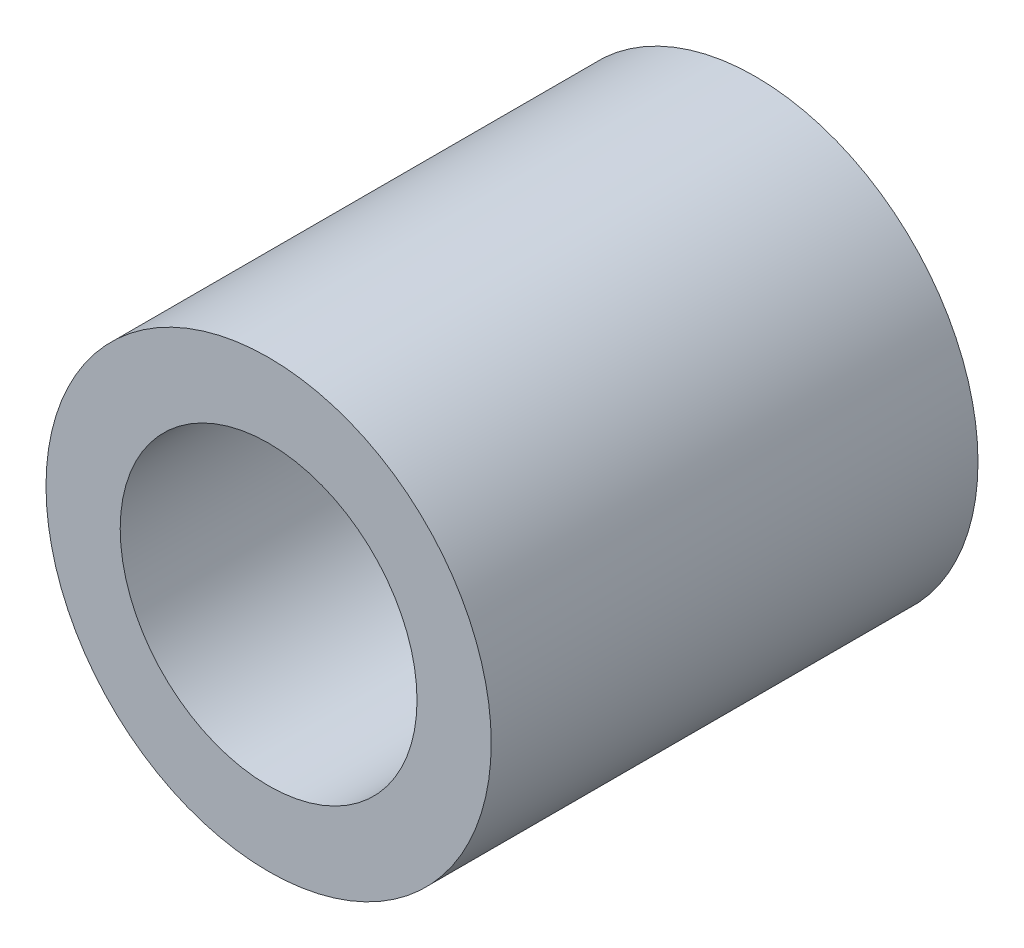
from build123d import *

# Parameters (mm, degrees)
SKETCH2_R           = 375
SKETCH2_R_2         = 250
BOSS_EXTRUDE1_DEPTH = 820


with BuildPart() as part:
    # Sketch2 → Boss-Extrude1 (new body)
    with BuildSketch(Plane.XY):
        with Locations(Location((0, 0, 0), (0, 0, 180))):
            Circle(SKETCH2_R)
        with Locations(Location((0, 0, 0), (0, 0, 180))):
            Circle(SKETCH2_R_2, mode=Mode.SUBTRACT)
    extrude(amount=BOSS_EXTRUDE1_DEPTH)


solid = part.part
